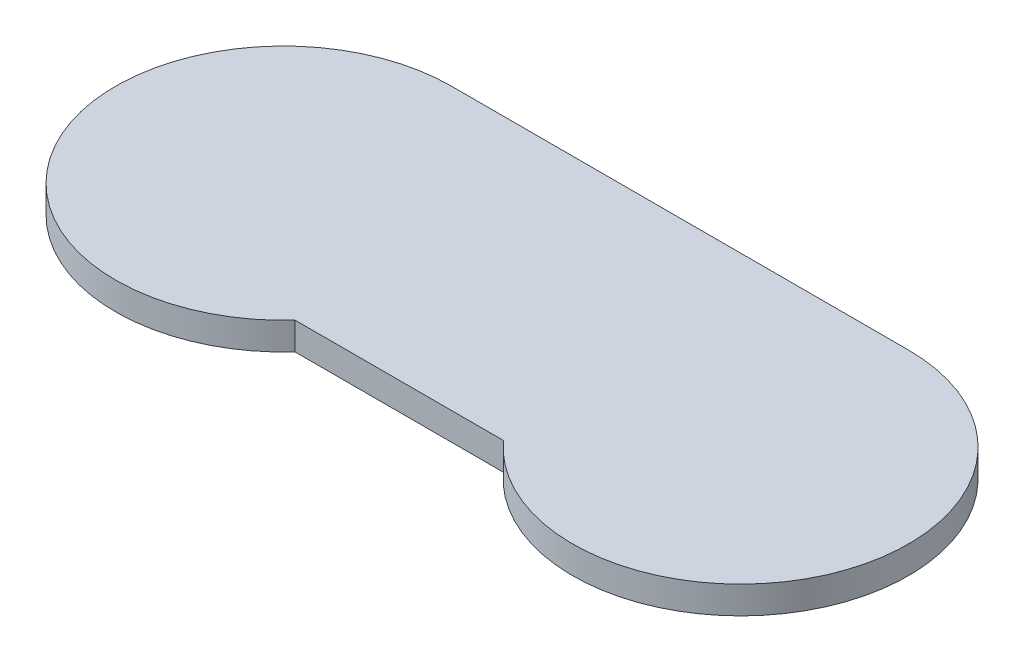
from build123d import *

# Parameters (mm, degrees)
BOSS_EXTRUDE1_DEPTH = 5


with BuildPart() as part:
    # Sketch1 → Boss-Extrude1 (new body)
    with BuildSketch(Plane(origin=(0, 0, 0), x_dir=(1, 0, 0), z_dir=(0, 1, 0))):
        with BuildLine():
            Line((41.5, 30.5), (-41.5, 30.5))
            ThreePointArc((-41.5, 30.5), (-69.388169535, -12.349089035), (-18.916820419, -20.5))
            Line((-18.916820419, -20.5), (18.916820419, -20.5))
            ThreePointArc((18.916820419, -20.5), (69.388169535, -12.349089035), (41.5, 30.5))
        make_face()
    extrude(amount=BOSS_EXTRUDE1_DEPTH)


solid = part.part
